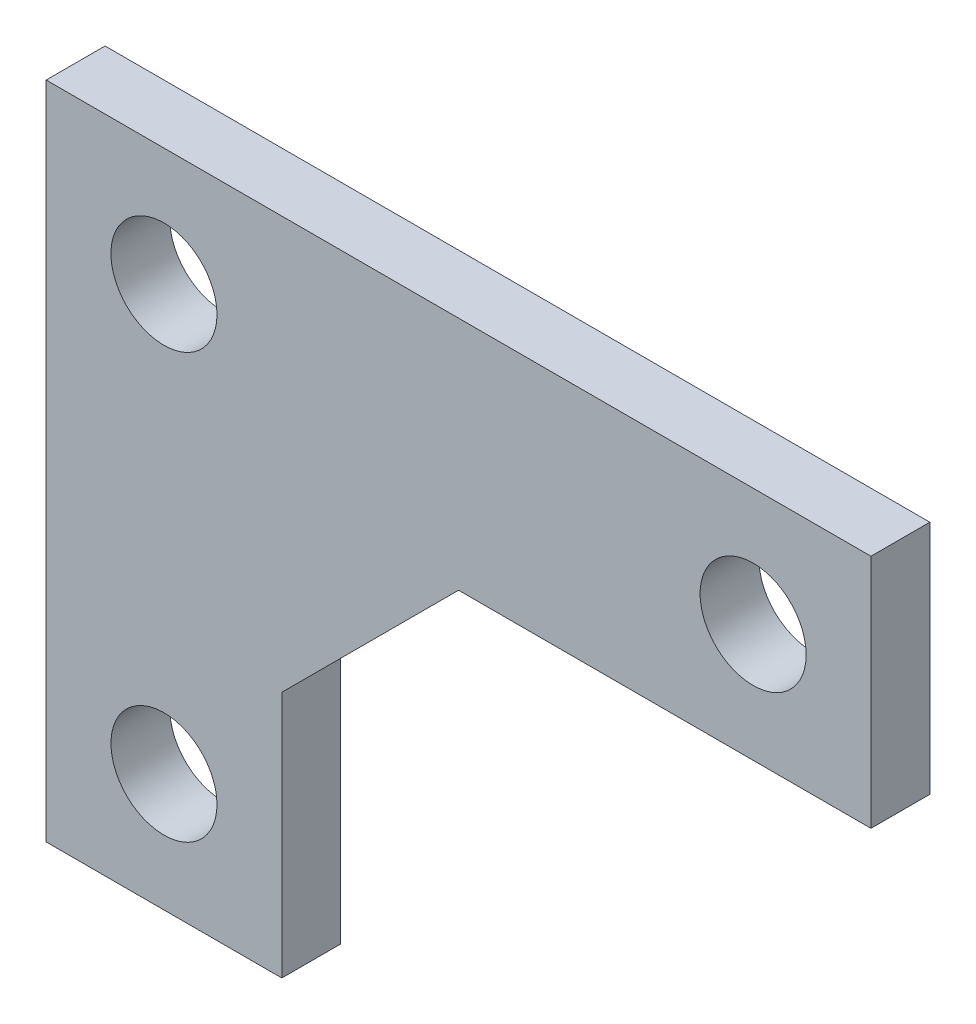
from build123d import *

# Parameters (mm, degrees)
SKETCH_1_R      = 4.5
EXTRUDE_1_DEPTH = 5
CHAMFER_1_SIZE  = 15


with BuildPart() as part:
    # 草图1 → 凸台-拉伸1 (new body)
    with BuildSketch(Plane.XY):
        Polygon((-10, 26), (-10, 10), (-10, -10), (10, -10), (10, 10), (10, 26), (40, 26), (60, 26), (60, 46), (40, 46), (10, 46), (-10, 46), align=None)
        Circle(SKETCH_1_R, mode=Mode.SUBTRACT)
        with Locations((0, 36)):
            Circle(SKETCH_1_R, mode=Mode.SUBTRACT)
        with Locations((50, 36)):
            Circle(SKETCH_1_R, mode=Mode.SUBTRACT)
    extrude(amount=-EXTRUDE_1_DEPTH)

    # 倒角1
    chamfer_1_edges = [part.edges().sort_by_distance(p)[0] for p in [
        (10, 26, -2.5),
    ]]
    chamfer(chamfer_1_edges, length=CHAMFER_1_SIZE)


solid = part.part
